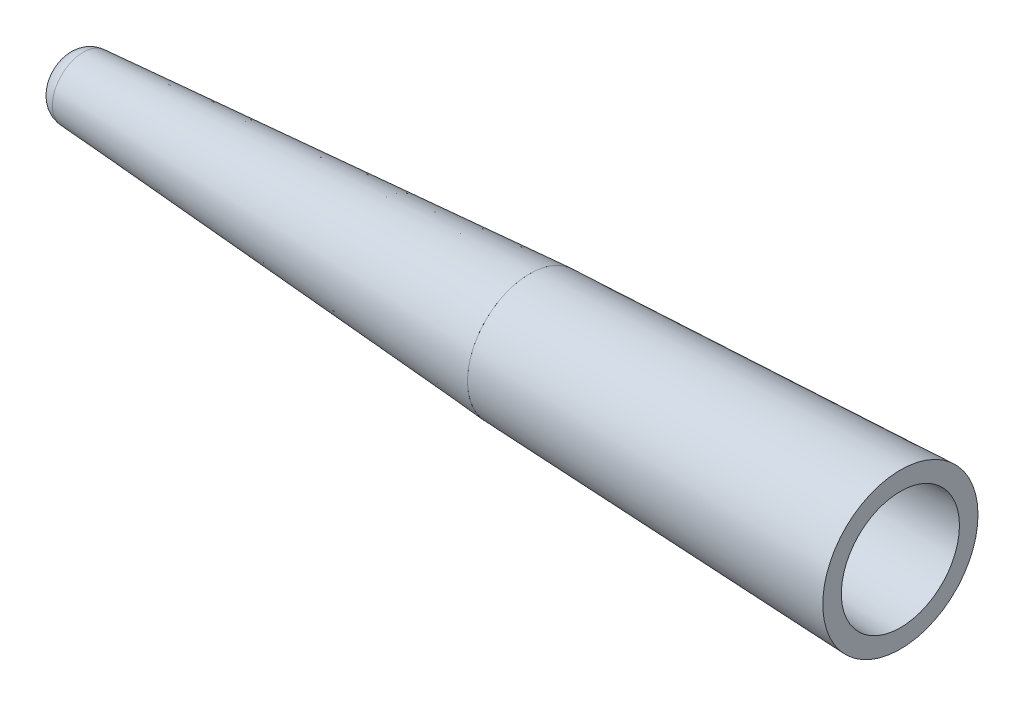
from build123d import *


with BuildPart() as part:
    # Sketch2 → Revolve2 (revolve)
    with BuildSketch(Plane.XY, mode=Mode.PRIVATE) as revolve2_sk:
        with BuildLine():
            Line((0, 1.2), (50, 4.696340597))
            Line((50, 4.696340597), (50, 6.696340597))
            Line((50, 6.696340597), (1.851094968, 3.32944117))
            ThreePointArc((1.851094968, 3.32944117), (0.484525778, 2.648094905), (0, 1.2))
        make_face()
    revolve(revolve2_sk.sketch.rotate(Axis((-19.275847123, 0, 0), (1, 0, 0)), 90), axis=Axis((-19.275847123, 0, 0), (1, 0, 0)))


with BuildPart() as body_2:
    # Sketch3 → Revolve3 (revolve)
    with BuildSketch(Plane.XY, mode=Mode.PRIVATE) as revolve3_sk:
        Polygon((50, 4.694584717), (180, 10.143199062), (180, 12.144954942), (50, 6.696340597), align=None)
    revolve(revolve3_sk.sketch.rotate(Axis((50, 0, 0), (-1, 0, 0)), 90), axis=Axis((50, 0, 0), (-1, 0, 0)))

    # SurfaceCut1
    split(bisect_by=Plane(origin=(90, 0, 0), x_dir=(0, 0, -1), z_dir=(1, 0, 0)), keep=Keep.BOTTOM)


solid = Compound([part.part, body_2.part])
